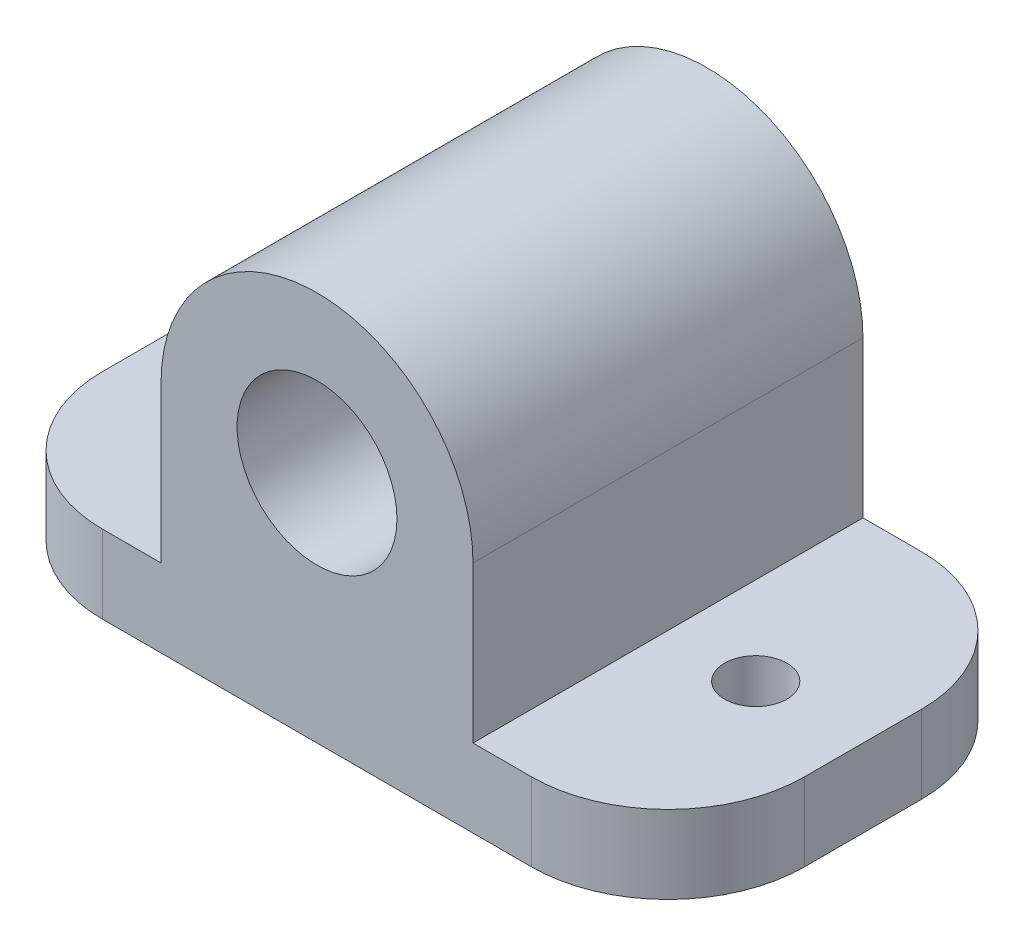
from build123d import *

# Parameters (mm, degrees)
ESBO_O1_R                = 4.1
RESSALTO_EXTRUS_O1_DEPTH = 20
ESBO_O2_R                = 1.6
CORTE_EXTRUS_O1_DEPTH    = 20
FILETE1_R                = 7


with BuildPart() as part:
    # Esboço1 → Ressalto-extrusão1 (new body)
    with BuildSketch(Plane.XY):
        with BuildLine():
            Line((-8, 0), (-8, -8))
            Line((-8, -8), (-18, -8))
            Line((-18, -8), (-18, -12))
            Line((-18, -12), (18, -12))
            Line((18, -12), (18, -8))
            Line((18, -8), (8, -8))
            Line((8, -8), (8, 0))
            ThreePointArc((8, 0), (0, 8), (-8, 0))
        make_face()
        Circle(ESBO_O1_R, mode=Mode.SUBTRACT)
    extrude(amount=RESSALTO_EXTRUS_O1_DEPTH)

    # Esboço2 → Corte-extrusão1 (cut)
    with BuildSketch(Plane(origin=(0, -8, 0), x_dir=(1, 0, 0), z_dir=(0, 1, 0))):
        with Locations(Location((-12.5, -10, 0), (0, 0, 180))):
            Circle(ESBO_O2_R)
        with Locations(Location((12.5, -10, 0), (0, 0, 180))):
            Circle(ESBO_O2_R)
    extrude(amount=-CORTE_EXTRUS_O1_DEPTH, mode=Mode.SUBTRACT)

    # Filete1
    filete1_edges = [part.edges().sort_by_distance(p)[0] for p in [
        (-18, -10, 20),
        (18, -10, 20),
        (18, -10, 0),
        (-18, -10, 0),
    ]]
    fillet(filete1_edges, radius=FILETE1_R)


solid = part.part
